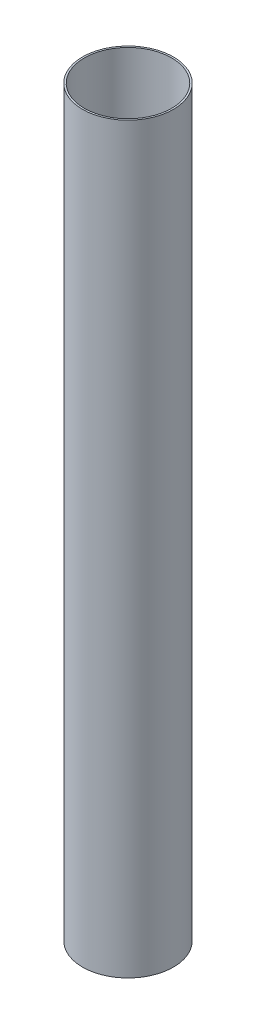
from build123d import *

# Parameters (mm, degrees)
SKETCH1_R           = 39.624
SKETCH1_R_2         = 38.1
BOSS_EXTRUDE1_DEPTH = 647.7


with BuildPart() as part:
    # Sketch1 → Boss-Extrude1 (new body)
    with BuildSketch(Plane(origin=(0, 0, 0), x_dir=(1, 0, 0), z_dir=(0, 1, 0))):
        with Locations(Location((0, 0, 0), (0, 0, 270))):
            Circle(SKETCH1_R)
        with Locations(Location((0, 0, 0), (0, 0, 270))):
            Circle(SKETCH1_R_2, mode=Mode.SUBTRACT)
    extrude(amount=BOSS_EXTRUDE1_DEPTH)


solid = part.part
